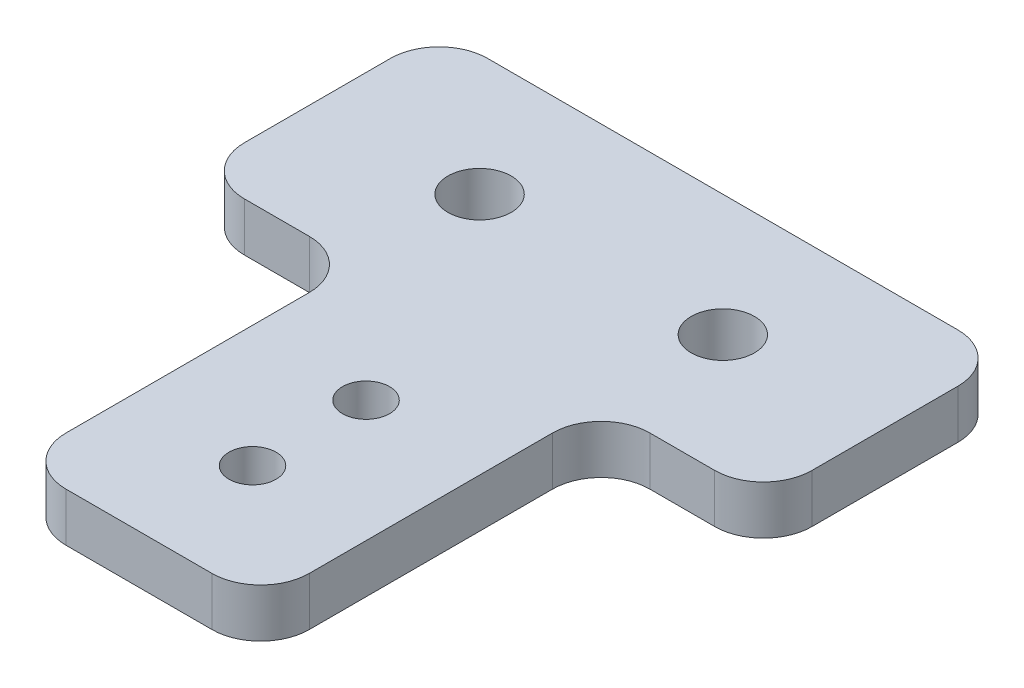
from build123d import *

# Parameters (mm, degrees)
SKETCH_1_R      = 1.45
SKETCH_1_R_2    = 1.95
EXTRUDE_1_DEPTH = 3
FILLET_2_R      = 3


with BuildPart() as part:
    # 草图1 → 凸台-拉伸1 (new body)
    with BuildSketch(Plane(origin=(0, 0, 0), x_dir=(1, 0, 0), z_dir=(0, 1, 0))):
        Polygon((-17.5, -7.5), (-17.5, 7.5), (17.5, 7.5), (17.5, -7.5), (7.5, -7.5), (7.5, -28.5), (-7.5, -28.5), (-7.5, -7.5), align=None)
        with Locations(Location((0, -14.5, 0), (0, 0, 270))):
            Circle(SKETCH_1_R, mode=Mode.SUBTRACT)
        with Locations(Location((0, -21.5, 0), (0, 0, 270))):
            Circle(SKETCH_1_R, mode=Mode.SUBTRACT)
        with Locations(Location((-7.5, 0, 0), (0, 0, 270))):
            Circle(SKETCH_1_R_2, mode=Mode.SUBTRACT)
        with Locations(Location((7.5, 0, 0), (0, 0, 90))):
            Circle(SKETCH_1_R_2, mode=Mode.SUBTRACT)
    extrude(amount=EXTRUDE_1_DEPTH)

    # 圆角2
    fillet_2_edges = [part.edges().sort_by_distance(p)[0] for p in [
        (17.5, 1.5, 7.5),
        (7.5, 1.5, 7.5),
        (7.5, 1.5, 28.5),
        (-7.5, 1.5, 28.5),
        (-7.5, 1.5, 7.5),
        (-17.5, 1.5, 7.5),
        (-17.5, 1.5, -7.5),
        (17.5, 1.5, -7.5),
    ]]
    fillet(fillet_2_edges, radius=FILLET_2_R)


solid = part.part
